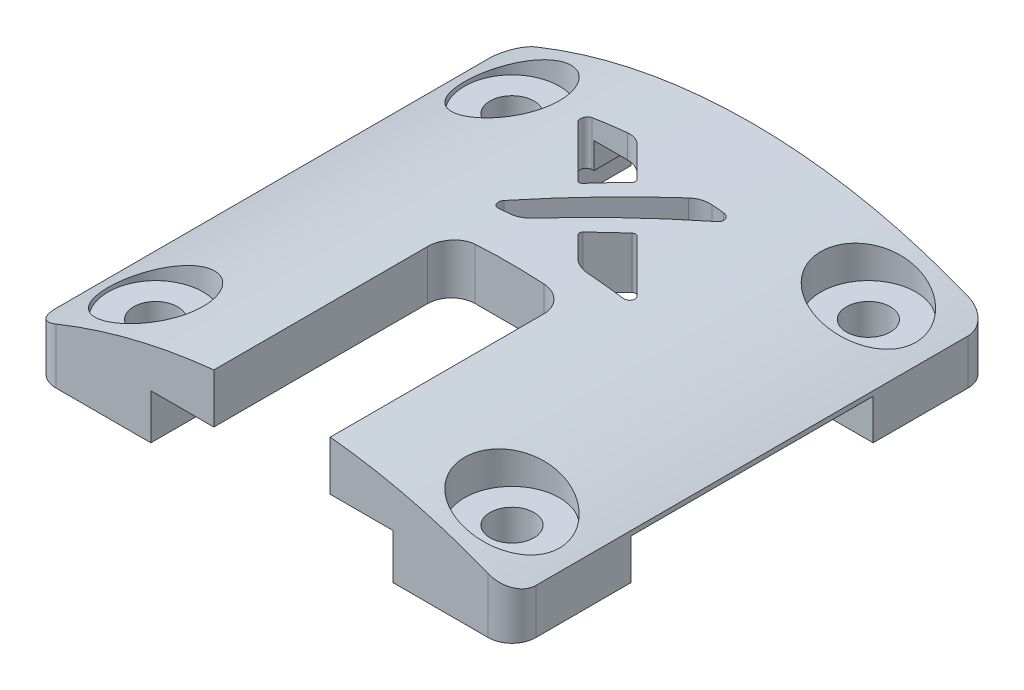
from build123d import *

# Parameters (mm, degrees)
EXTRUDE_1_DEPTH     = 20.2
SKETCH_4_W          = 4.5
SKETCH_4_H          = 1.2
CUT_EXTRUDE_1_DEPTH = 10
SKETCH_5_W          = 4.5
SKETCH_5_H          = 10
CUT_EXTRUDE_2_DEPTH = 10
SKETCH_6_W          = 5
SKETCH_6_H          = 5
EXTRUDE_2_DEPTH     = 1.4
SKETCH_7_W          = 7.6
SKETCH_7_H          = 2.5
CUT_EXTRUDE_3_DEPTH = 5
SKETCH_8_R          = 1
CUT_EXTRUDE_4_DEPTH = 5
SKETCH_9_R          = 2
CUT_EXTRUDE_5_DEPTH = 1.5
CUT_EXTRUDE_6_DEPTH = 5
CUT_EXTRUDE_7_DEPTH = 5
SKETCH_12_R         = 1
SKETCH_12_R_2       = 0.925
EXTRUDE_3_DEPTH     = 1.5
SKETCH_13_W         = 10
SKETCH_13_H         = 2.102852528
CUT_EXTRUDE_8_DEPTH = 0.2
SKETCH_14_W         = 10
SKETCH_14_H         = 2.102852528
CUT_EXTRUDE_9_DEPTH = 0.2
FILLET_2_R          = 1
EXTRUDE_START       = 0.5
SKETCH_15_R         = 0.925
EXTRUDE_4_DEPTH     = 0.5
SKETCH_16_W         = 5
SKETCH_16_H         = 10.2
EXTRUDE_5_DEPTH     = 0.2


with BuildPart() as part:
    # 草图3 → 凸台-拉伸1 (new body)
    with BuildSketch(Plane.XY):
        with BuildLine():
            Line((-10.1, 22), (10.1, 22))
            ThreePointArc((10.1, 22), (0, 24.207643421), (-10.1, 22))
        make_face()
    extrude(amount=EXTRUDE_1_DEPTH)

    # 草图4 → 切除-拉伸1 (cut)
    with BuildSketch(Plane(origin=(6.414908285, -11.03, 20.2), x_dir=(1, 0, 0), z_dir=(0, 0, 1))):
        with Locations((-6.414908285, 33.63)):
            Rectangle(SKETCH_4_W, SKETCH_4_H)
    extrude(amount=-CUT_EXTRUDE_1_DEPTH, mode=Mode.SUBTRACT)

    # 草图5 → 切除-拉伸2 (cut)
    with BuildSketch(Plane.XZ.offset(-23.2)):
        with Locations((0, 15.2)):
            Rectangle(SKETCH_5_W, SKETCH_5_H)
    extrude(amount=-CUT_EXTRUDE_2_DEPTH, mode=Mode.SUBTRACT)

    # 草图6 → 凸台-拉伸2 (add)
    with BuildSketch(Plane.XZ.offset(-22)):
        with Locations((-7.6, 17.7)):
            Rectangle(SKETCH_6_W, SKETCH_6_H)
        with Locations((-7.6, 2.5)):
            Rectangle(SKETCH_6_W, SKETCH_6_H)
        with Locations((7.6, 2.5)):
            Rectangle(SKETCH_6_W, SKETCH_6_H)
        with Locations((7.6, 17.7)):
            Rectangle(SKETCH_6_W, SKETCH_6_H)
    extrude(amount=EXTRUDE_2_DEPTH)

    # 草图7 → 切除-拉伸3 (cut)
    with BuildSketch(Plane(origin=(6.414908285, -11.03, 0), x_dir=(1, 0, 0), z_dir=(0, 0, -1))):
        with Locations((-6.414908285, -32.88)):
            Rectangle(SKETCH_7_W, SKETCH_7_H)
    extrude(amount=-CUT_EXTRUDE_3_DEPTH, mode=Mode.SUBTRACT)

    # 草图8 → 切除-拉伸4 (cut)
    with BuildSketch(Plane(origin=(6.414908285, 20.6, 10.797250082), x_dir=(-1, 0, 0), z_dir=(0, -1, 0))):
        with Locations(Location((13.914908285, -6.802749918, 0), (0, 0, 90))):
            Circle(SKETCH_8_R)
        with Locations(Location((-1.085091715, -6.802749918, 0), (0, 0, 90))):
            Circle(SKETCH_8_R)
        with Locations(Location((-1.085091715, 8.197250082, 0), (0, 0, 90))):
            Circle(SKETCH_8_R)
        with Locations(Location((13.914908285, 8.197250082, 0), (0, 0, 90))):
            Circle(SKETCH_8_R)
    extrude(amount=-CUT_EXTRUDE_4_DEPTH, mode=Mode.SUBTRACT)

    # 草图9 → 切除-拉伸5 (cut)
    with BuildSketch(Plane(origin=(0, 23.6, 0), x_dir=(-1, 0, 0), z_dir=(0, -1, 0))):
        with Locations(Location((7.5, -2.6, 0), (0, 0, 270))):
            Circle(SKETCH_9_R)
        with Locations(Location((-7.5, -2.6, 0), (0, 0, 270))):
            Circle(SKETCH_9_R)
        with Locations(Location((7.5, -17.6, 0), (0, 0, 270))):
            Circle(SKETCH_9_R)
        with Locations(Location((-7.5, -17.6, 0), (0, 0, 270))):
            Circle(SKETCH_9_R)
    extrude(amount=CUT_EXTRUDE_5_DEPTH, mode=Mode.SUBTRACT)

    # 草图10 → 切除-拉伸6 (cut)
    with BuildSketch(Plane(origin=(6.414908285, 22, 10.797250082), x_dir=(-1, 0, 0), z_dir=(0, -1, 0))):
        with BuildLine():
            Line((7.57208535, 2.759943394), (3.695561186, 6.636467557))
            ThreePointArc((3.695561186, 6.636467557), (3.641367999, 6.908915111), (3.872337882, 7.063244252))
            Line((3.872337882, 7.063244252), (4.354570929, 7.063244252))
            ThreePointArc((4.354570929, 7.063244252), (4.737254361, 6.987123785), (5.06167771, 6.770351034))
            Line((5.06167771, 6.770351034), (8.938201874, 2.89382687))
            ThreePointArc((8.938201874, 2.89382687), (8.992395061, 2.621379317), (8.761425178, 2.467050175))
            Line((8.761425178, 2.467050175), (8.279192131, 2.467050175))
            ThreePointArc((8.279192131, 2.467050175), (7.896508699, 2.543170642), (7.57208535, 2.759943394))
        make_face()
        with BuildLine():
            Line((4.965840766, 4.305527806), (6.003708732, 3.26765984))
            ThreePointArc((6.003708732, 3.26765984), (6.047642714, 3.161593823), (6.003708732, 3.055527806))
            Line((6.003708732, 3.055527806), (5.182998054, 2.234817128))
            ThreePointArc((5.182998054, 2.234817128), (4.858574705, 2.018044376), (4.475891272, 1.941923909))
            Line((4.475891272, 1.941923909), (2.993658225, 1.941923909))
            ThreePointArc((2.993658225, 1.941923909), (2.762688342, 2.096253051), (2.81688153, 2.368700604))
            Line((2.81688153, 2.368700604), (4.753708732, 4.305527806))
            ThreePointArc((4.753708732, 4.305527806), (4.859774749, 4.349461789), (4.965840766, 4.305527806))
        make_face()
        with BuildLine():
            Line((7.814368903, 5.078320012), (6.776500938, 6.116187978))
            ThreePointArc((6.776500938, 6.116187978), (6.732566955, 6.222253995), (6.776500938, 6.328320012))
            Line((6.776500938, 6.328320012), (8.097211616, 7.64903069))
            ThreePointArc((8.097211616, 7.64903069), (8.421634965, 7.865803441), (8.804318397, 7.941923909))
            Line((8.804318397, 7.941923909), (10.286551444, 7.941923909))
            ThreePointArc((10.286551444, 7.941923909), (10.517521327, 7.787594767), (10.463328139, 7.515147214))
            Line((10.463328139, 7.515147214), (8.026500938, 5.078320012))
            ThreePointArc((8.026500938, 5.078320012), (7.920434921, 5.034386029), (7.814368903, 5.078320012))
        make_face()
    extrude(amount=-CUT_EXTRUDE_6_DEPTH, mode=Mode.SUBTRACT)

    # 草图11 → 切除-拉伸7 (cut)
    with BuildSketch(Plane(origin=(6.414908285, 20.6, 10.797250082), x_dir=(-1, 0, 0), z_dir=(0, -1, 0))):
        with BuildLine():
            Line((16.514908285, -9.402749918), (16.514908285, -8.402749918))
            ThreePointArc((16.514908285, -8.402749918), (16.222015066, -9.109856699), (15.514908285, -9.402749918))
            Line((15.514908285, -9.402749918), (16.514908285, -9.402749918))
        make_face()
        with BuildLine():
            Line((-3.685091715, -9.402749918), (-2.685091715, -9.402749918))
            ThreePointArc((-2.685091715, -9.402749918), (-3.392198496, -9.109856699), (-3.685091715, -8.402749918))
            Line((-3.685091715, -8.402749918), (-3.685091715, -9.402749918))
        make_face()
        with BuildLine():
            Line((-3.685091715, 10.797250082), (-3.685091715, 9.797250082))
            ThreePointArc((-3.685091715, 9.797250082), (-3.392198496, 10.504356863), (-2.685091715, 10.797250082))
            Line((-2.685091715, 10.797250082), (-3.685091715, 10.797250082))
        make_face()
        with BuildLine():
            Line((16.514908285, 10.797250082), (15.514908285, 10.797250082))
            ThreePointArc((15.514908285, 10.797250082), (16.222015066, 10.504356863), (16.514908285, 9.797250082))
            Line((16.514908285, 9.797250082), (16.514908285, 10.797250082))
        make_face()
    extrude(amount=-CUT_EXTRUDE_7_DEPTH, mode=Mode.SUBTRACT)

    # 草图12 → 凸台-拉伸3 (add)
    # profile 1 of 4: a face of its own
    with BuildSketch(Plane.XZ.offset(-20.6)):
        with Locations((7.5, 17.6)):
            Circle(SKETCH_12_R)
        with Locations(Location((7.5, 17.6, 0), (0, 0, 270))):
            Circle(SKETCH_12_R_2, mode=Mode.SUBTRACT)
    # profile 2 of 4: a face of its own
    with BuildSketch(Plane.XZ.offset(-20.6)):
        with Locations((-7.5, 17.6)):
            Circle(SKETCH_12_R)
        with Locations(Location((-7.5, 17.6, 0), (0, 0, 270))):
            Circle(SKETCH_12_R_2, mode=Mode.SUBTRACT)
    # profile 3 of 4: a face of its own
    with BuildSketch(Plane.XZ.offset(-20.6)):
        with Locations((-7.5, 2.6)):
            Circle(SKETCH_12_R)
        with Locations(Location((-7.5, 2.6, 0), (0, 0, 270))):
            Circle(SKETCH_12_R_2, mode=Mode.SUBTRACT)
    # profile 4 of 4: a face of its own
    with BuildSketch(Plane.XZ.offset(-20.6)):
        with Locations((7.5, 2.6)):
            Circle(SKETCH_12_R)
        with Locations(Location((7.5, 2.6, 0), (0, 0, 270))):
            Circle(SKETCH_12_R_2, mode=Mode.SUBTRACT)
    extrude(amount=-EXTRUDE_3_DEPTH)

    # 草图13 → 切除-拉伸8 (cut)
    with BuildSketch(Plane.ZY.offset(-2.25)):
        with Locations((15.2, 23.051426264)):
            Rectangle(SKETCH_13_W, SKETCH_13_H)
    extrude(amount=-CUT_EXTRUDE_8_DEPTH, mode=Mode.SUBTRACT)

    # 草图14 → 切除-拉伸9 (cut)
    with BuildSketch(Plane(origin=(-2.25, 0, 0), x_dir=(0, 0, -1), z_dir=(1, 0, 0))):
        with Locations((-15.2, 23.051426264)):
            Rectangle(SKETCH_14_W, SKETCH_14_H)
    extrude(amount=-CUT_EXTRUDE_9_DEPTH, mode=Mode.SUBTRACT)

    # 圆角2
    fillet_2_edges = [part.edges().sort_by_distance(p)[0] for p in [
        (2.45, 23.041672434, 10.2),
        (-2.45, 23.041672434, 10.2),
    ]]
    fillet(fillet_2_edges, radius=FILLET_2_R)

    # 草图15 → 凸台-拉伸4 (add)
    # profile 1 of 4: a face of its own
    with BuildSketch(Plane.XZ.offset(-20.6).offset(EXTRUDE_START)):
        with BuildLine():
            Line((-10.1, 5), (-10.1, 1))
            ThreePointArc((-10.1, 1), (-9.807106781, 0.292893219), (-9.1, 0))
            Line((-9.1, 0), (-5.1, 0))
            Line((-5.1, 0), (-5.1, 5))
            Line((-5.1, 5), (-10.1, 5))
        make_face()
        with Locations(Location((-7.5, 2.6, 0), (0, 0, 270))):
            Circle(SKETCH_15_R, mode=Mode.SUBTRACT)
    # profile 2 of 4: a face of its own
    with BuildSketch(Plane.XZ.offset(-20.6).offset(EXTRUDE_START)):
        with BuildLine():
            Line((-10.1, 19.2), (-10.1, 15.2))
            Line((-10.1, 15.2), (-5.1, 15.2))
            Line((-5.1, 15.2), (-5.1, 20.2))
            Line((-5.1, 20.2), (-9.1, 20.2))
            ThreePointArc((-9.1, 20.2), (-9.807106781, 19.907106781), (-10.1, 19.2))
        make_face()
        with Locations(Location((-7.5, 17.6, 0), (0, 0, 270))):
            Circle(SKETCH_15_R, mode=Mode.SUBTRACT)
    # profile 3 of 4: a face of its own
    with BuildSketch(Plane.XZ.offset(-20.6).offset(EXTRUDE_START)):
        with BuildLine():
            Line((9.1, 20.2), (5.1, 20.2))
            Line((5.1, 20.2), (5.1, 15.2))
            Line((5.1, 15.2), (10.1, 15.2))
            Line((10.1, 15.2), (10.1, 19.2))
            ThreePointArc((10.1, 19.2), (9.807106781, 19.907106781), (9.1, 20.2))
        make_face()
        with Locations(Location((7.5, 17.6, 0), (0, 0, 270))):
            Circle(SKETCH_15_R, mode=Mode.SUBTRACT)
    # profile 4 of 4: a face of its own
    with BuildSketch(Plane.XZ.offset(-20.6).offset(EXTRUDE_START)):
        with BuildLine():
            Line((5.1, 0), (9.1, 0))
            ThreePointArc((9.1, 0), (9.807106781, 0.292893219), (10.1, 1))
            Line((10.1, 1), (10.1, 5))
            Line((10.1, 5), (5.1, 5))
            Line((5.1, 5), (5.1, 0))
        make_face()
        with Locations(Location((7.5, 2.6, 0), (0, 0, 270))):
            Circle(SKETCH_15_R, mode=Mode.SUBTRACT)
    extrude(amount=-EXTRUDE_4_DEPTH)

    # 草图16 → 凸台-拉伸5 (add)
    with BuildSketch(Plane.XZ.offset(-22)):
        with Locations((-7.6, 10.1)):
            Rectangle(SKETCH_16_W, SKETCH_16_H)
        with Locations((7.6, 10.1)):
            Rectangle(SKETCH_16_W, SKETCH_16_H)
    extrude(amount=EXTRUDE_5_DEPTH)


solid = part.part
